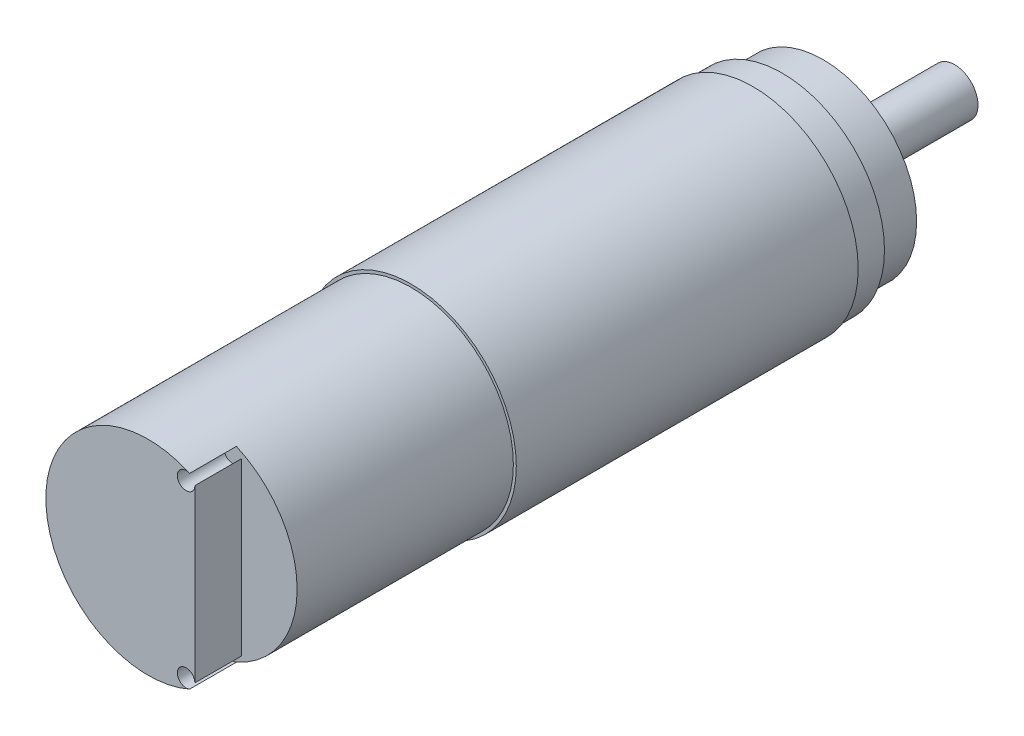
from build123d import *

# Parameters (mm, degrees)
SKETCH1_R           = 16
SKETCH1_R_2         = 1.75
SKETCH1_R_3         = 11.25
BOSS_EXTRUDE1_DEPTH = 7
SKETCH2_R           = 17.5
BOSS_EXTRUDE2_DEPTH = 108.5
SKETCH3_R           = 4
BOSS_EXTRUDE3_DEPTH = 22.5
BOSS_EXTRUDE4_START = -103.5
SKETCH4_R           = 18
SKETCH4_R_2         = 17.5
BOSS_EXTRUDE4_DEPTH = 58.5
CUT_EXTRUDE1_START  = -8
CUT_EXTRUDE1_DEPTH  = 8
CUT_EXTRUDE3_START  = -8
CUT_EXTRUDE3_DEPTH  = 8


with BuildPart() as part:
    # Sketch1 → Boss-Extrude1 (new body)
    # profile 1 of 2: a face of its own
    with BuildSketch(Plane.XY):
        Circle(SKETCH1_R)
        with Locations((9.899494937, 9.899494937)):
            Circle(SKETCH1_R_2, mode=Mode.SUBTRACT)
        with Locations((-9.899494937, 9.899494937)):
            Circle(SKETCH1_R_2, mode=Mode.SUBTRACT)
        with Locations((-9.899494937, -9.899494937)):
            Circle(SKETCH1_R_2, mode=Mode.SUBTRACT)
        with Locations((9.899494937, -9.899494937)):
            Circle(SKETCH1_R_2, mode=Mode.SUBTRACT)
        Circle(SKETCH1_R_3, mode=Mode.SUBTRACT)
    # profile 2 of 2: a face of its own
    with BuildSketch(Plane.XY):
        Circle(SKETCH1_R_3)
    extrude(amount=BOSS_EXTRUDE1_DEPTH)

    # Sketch2 → Boss-Extrude2 (add)
    with BuildSketch(Plane.XY.offset(7)):
        Circle(SKETCH2_R)
    extrude(amount=BOSS_EXTRUDE2_DEPTH)

    # Sketch3 → Boss-Extrude3 (add)
    with BuildSketch(Plane(origin=(0, 0, 0), x_dir=(-1, 0, 0), z_dir=(0, 0, -1))):
        with Locations(Location((0, 0, 0), (0, 0, 180))):
            Circle(SKETCH3_R)
    extrude(amount=BOSS_EXTRUDE3_DEPTH)

    # Sketch4 → Boss-Extrude4 (add)
    with BuildSketch(Plane.XY.offset(115.5).offset(BOSS_EXTRUDE4_START)):
        Circle(SKETCH4_R)
        Circle(SKETCH4_R_2, mode=Mode.SUBTRACT)
    extrude(amount=BOSS_EXTRUDE4_DEPTH)

    # Sketch5 → Cut-Extrude1 (cut)
    with BuildSketch(Plane.XY.offset(115.5).offset(CUT_EXTRUDE1_START)):
        with BuildLine():
            Line((8, 15.564382416), (8, -15.564382416))
            ThreePointArc((8, -15.564382416), (17.5, 0), (8, 15.564382416))
        make_face()
    extrude(amount=CUT_EXTRUDE1_DEPTH, mode=Mode.SUBTRACT)

    # Sketch6 → Cut-Extrude3 (cut)
    with BuildSketch(Plane.XY.offset(115.5).offset(CUT_EXTRUDE3_START)):
        with BuildLine():
            Line((8, 14.620191517), (8, 15.564382416))
            ThreePointArc((8, 15.564382416), (7.557695982, 15.783891518), (7.109375, 15.990834472))
            ThreePointArc((7.109375, 15.990834472), (5.242211763, 13.802897965), (8, 14.620191517))
        make_face()
        with BuildLine():
            Line((8, -15.564382416), (8, -14.620191517))
            ThreePointArc((8, -14.620191517), (5.242211763, -13.802897965), (7.109375, -15.990834472))
            ThreePointArc((7.109375, -15.990834472), (7.557695982, -15.783891518), (8, -15.564382416))
        make_face()
    extrude(amount=CUT_EXTRUDE3_DEPTH, mode=Mode.SUBTRACT)


solid = part.part
